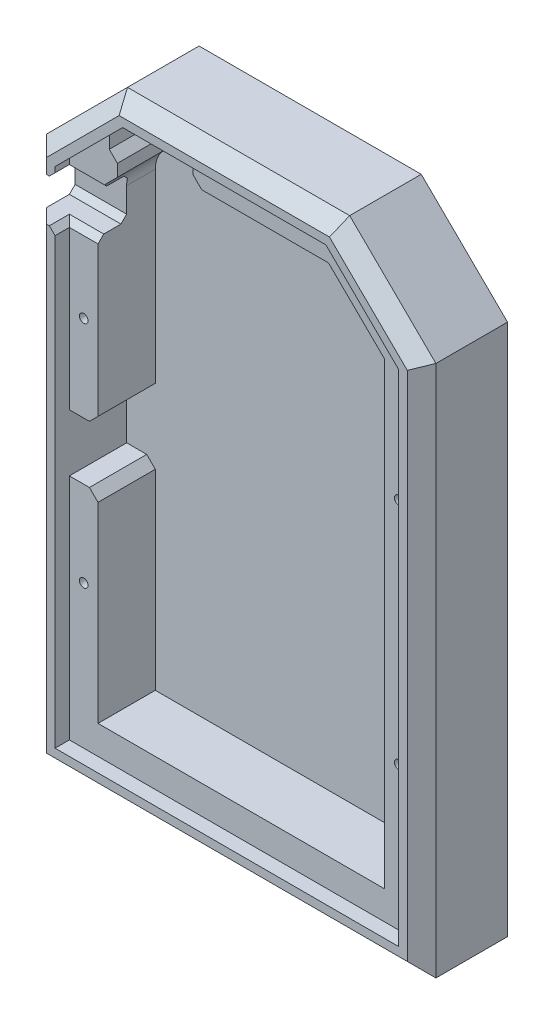
from build123d import *

# Parameters (mm, degrees)
SKETCH1_R               = 1.5
SKETCH1_W               = 20
SKETCH1_H               = 10
SKETCH1_H_2             = 2.227118871
BOSS_EXTRUDE1_DEPTH     = 5
SKETCH1_3_R             = 1.5
BOSS_EXTRUDE2_DEPTH     = 25
BOSS_EXTRUDE3_START     = 25
BOSS_EXTRUDE3_DEPTH     = 5
CHAMFER1_SIZE           = 5
CHAMFER2_SIZE           = 3
CUT_EXTRUDE1_DEPTH      = 5
CUT_EXTRUDE1_DEPTH_BACK = 15
SKETCH2_R               = 1.5
SKETCH2_W               = 25.232105948
SKETCH2_H               = 15
CHAMFER3_SIZE           = 2
FILLET1_R               = 10


with BuildPart() as part:
    # Sketch1 → Boss-Extrude1 (new body)
    # profile 1 of 12: a face of its own
    with BuildSketch(Plane(origin=(0, 0, 0), x_dir=(0, 1, 0), z_dir=(0, 0, 1))):
        Polygon((177.850961936, -128), (205.201570355, -100.211781846), (207.5, -97.876577327), (207.5, -94.6), (207.5, -23.6), (207.5, -20.286291501), (205.156854249, -17.943145751), (200.801342876, -13.587634377), (179.213708499, 8), (-8, 8), (-8, -128), align=None)
        Polygon((99.85, 0), (175.9, 0), (187.7, -11.8), (199.5, -23.6), (199.5, -43.189183287), (199.5, -94.6), (174.5, -120), (0, -120), (0, 0), (79.85, 0), align=None, mode=Mode.SUBTRACT)
    # profile 2 of 12: a face of its own
    with BuildSketch(Plane(origin=(0, 0, 0), x_dir=(0, 1, 0), z_dir=(0, 0, 1))):
        Polygon((79.85, -10), (79.85, 0), (0, 0), (0, -120), (174.5, -120), (199.5, -94.6), (199.5, -43.189183287), (189.5, -43.189183287), (189.5, -90.504278342), (170.31129758, -110), (10, -110), (10, -10), align=None)
        with Locations((50, -115)):
            Circle(SKETCH1_R, mode=Mode.SUBTRACT)
        with Locations((130, -115)):
            Circle(SKETCH1_R, mode=Mode.SUBTRACT)
        with Locations((50, -5)):
            Circle(SKETCH1_R, mode=Mode.SUBTRACT)
    # profile 3 of 12: a face of its own
    with BuildSketch(Plane(origin=(0, 0, 0), x_dir=(0, 1, 0), z_dir=(0, 0, 1))):
        Polygon((169.825042534, -29.674957466), (180.628932188, -18.871067812), (171.757864376, -10), (99.85, -10), (99.85, -12.227118871), (79.85, -12.227118871), (79.85, -10), (10, -10), (10, -110), (170.31129758, -110), (189.5, -90.504278342), (189.5, -43.189183287), (183.339268355, -43.189183287), align=None)
    # profile 4 of 12: a face of its own
    with BuildSketch(Plane(origin=(0, 0, 0), x_dir=(0, 1, 0), z_dir=(0, 0, 1))):
        Polygon((199.5, -23.6), (187.7, -11.8), (180.628932188, -18.871067812), (189.5, -27.742135624), (189.5, -43.189183287), (199.5, -43.189183287), align=None)
    # profile 5 of 12: a face of its own
    with BuildSketch(Plane(origin=(0, 0, 0), x_dir=(0, 1, 0), z_dir=(0, 0, 1))):
        Polygon((187.7, -11.8), (175.9, 0), (99.85, 0), (99.85, -10), (171.757864376, -10), (180.628932188, -18.871067812), align=None)
        with Locations((130, -5)):
            Circle(SKETCH1_R, mode=Mode.SUBTRACT)
    # profile 6 of 12: a face of its own
    with BuildSketch(Plane(origin=(0, 0, 0), x_dir=(0, 1, 0), z_dir=(0, 0, 1))):
        Polygon((189.5, -27.742135624), (180.628932188, -18.871067812), (169.825042534, -29.674957466), (183.339268355, -43.189183287), (189.5, -43.189183287), align=None)
    # profile 7 of 12: a face of its own
    with BuildSketch(Plane(origin=(0, 0, 0), x_dir=(0, 1, 0), z_dir=(0, 0, 1))):
        with Locations((89.85, -5)):
            Rectangle(SKETCH1_W, SKETCH1_H)
    # profile 8 of 12: a face of its own
    with BuildSketch(Plane(origin=(0, 0, 0), x_dir=(0, 1, 0), z_dir=(0, 0, 1))):
        with Locations((89.85, -11.113559436)):
            Rectangle(SKETCH1_W, SKETCH1_H_2)
    # profile 9 of 12: a face of its own
    with BuildSketch(Plane(origin=(0, 0, 0), x_dir=(0, 1, 0), z_dir=(0, 0, 1))):
        with Locations((50, -5)):
            Circle(SKETCH1_R)
    # profile 10 of 12: a face of its own
    with BuildSketch(Plane(origin=(0, 0, 0), x_dir=(0, 1, 0), z_dir=(0, 0, 1))):
        with Locations((130, -5)):
            Circle(SKETCH1_R)
    # profile 11 of 12: a face of its own
    with BuildSketch(Plane(origin=(0, 0, 0), x_dir=(0, 1, 0), z_dir=(0, 0, 1))):
        with Locations((130, -115)):
            Circle(SKETCH1_R)
    # profile 12 of 12: a face of its own
    with BuildSketch(Plane(origin=(0, 0, 0), x_dir=(0, 1, 0), z_dir=(0, 0, 1))):
        with Locations((50, -115)):
            Circle(SKETCH1_R)
    extrude(amount=BOSS_EXTRUDE1_DEPTH)

    # Sketch1<3> → Boss-Extrude2 (add)
    # profile 1 of 3: a face of its own
    with BuildSketch(Plane(origin=(0, 0, 0), x_dir=(0, 1, 0), z_dir=(0, 0, 1))):
        Polygon((177.850961936, -128), (205.201570355, -100.211781846), (207.5, -97.876577327), (207.5, -94.6), (207.5, -23.6), (207.5, -20.286291501), (205.156854249, -17.943145751), (200.801342876, -13.587634377), (179.213708499, 8), (-8, 8), (-8, -128), align=None)
        Polygon((99.85, 0), (175.9, 0), (187.7, -11.8), (199.5, -23.6), (199.5, -43.189183287), (199.5, -94.6), (174.5, -120), (0, -120), (0, 0), (79.85, 0), align=None, mode=Mode.SUBTRACT)
    # profile 2 of 3: a face of its own
    with BuildSketch(Plane(origin=(0, 0, 0), x_dir=(0, 1, 0), z_dir=(0, 0, 1))):
        Polygon((187.7, -11.8), (175.9, 0), (99.85, 0), (99.85, -10), (171.757864376, -10), (180.628932188, -18.871067812), align=None)
        with Locations(Location((130, -5, 0), (0, 0, 270))):
            Circle(SKETCH1_3_R, mode=Mode.SUBTRACT)
    # profile 3 of 3: a face of its own
    with BuildSketch(Plane(origin=(0, 0, 0), x_dir=(0, 1, 0), z_dir=(0, 0, 1))):
        Polygon((79.85, -10), (79.85, 0), (0, 0), (0, -120), (174.5, -120), (199.5, -94.6), (199.5, -43.189183287), (189.5, -43.189183287), (189.5, -90.504278342), (170.31129758, -110), (10, -110), (10, -10), align=None)
        with Locations(Location((50, -115, 0), (0, 0, 270))):
            Circle(SKETCH1_3_R, mode=Mode.SUBTRACT)
        with Locations(Location((130, -115, 0), (0, 0, 270))):
            Circle(SKETCH1_3_R, mode=Mode.SUBTRACT)
        with Locations(Location((50, -5, 0), (0, 0, 270))):
            Circle(SKETCH1_3_R, mode=Mode.SUBTRACT)
    extrude(amount=BOSS_EXTRUDE2_DEPTH)

    # Sketch1<4> → Boss-Extrude3 (add)
    with BuildSketch(Plane(origin=(0, 0, 0), x_dir=(0, 1, 0), z_dir=(0, 0, 1)).offset(BOSS_EXTRUDE3_START)):
        Polygon((177.850961936, -128), (205.201570355, -100.211781846), (207.5, -97.876577327), (207.5, -94.6), (207.5, -23.6), (207.5, -20.286291501), (205.156854249, -17.943145751), (200.801342876, -13.587634377), (179.213708499, 8), (-8, 8), (-8, -128), align=None)
        Polygon((99.85, 0), (175.9, 0), (187.7, -11.8), (199.5, -23.6), (199.5, -43.189183287), (199.5, -94.6), (174.5, -120), (0, -120), (0, 0), (79.85, 0), align=None, mode=Mode.SUBTRACT)
    extrude(amount=BOSS_EXTRUDE3_DEPTH)

    # Chamfer1
    chamfer1_edges = [part.edges().sort_by_distance(p)[0] for p in [
        (-8, 85.606854249, 30),
        (112.938288663, 192.675480968, 30),
        (59.081434414, 207.5, 30),
        (6.143145751, 193.356854249, 30),
        (60, -8, 30),
        (128, 84.925480968, 30),
    ]]
    chamfer(chamfer1_edges, length=CHAMFER1_SIZE)

    # Chamfer2
    chamfer2_edges = [part.edges().sort_by_distance(p)[0] for p in [
        (10, 79.85, 15),
        (10, 99.85, 15),
        (18.871067812, 180.628932188, 15),
        (11.8, 187.7, 15),
        (43.189183287, 199.5, 15),
        (43.189183287, 189.5, 15),
    ]]
    chamfer(chamfer2_edges, length=CHAMFER2_SIZE)

    # Sketch2 → Cut-Extrude1 (cut, two sides: drawn at the far end of the back side and taken through both)
    with BuildSketch(Plane.XY.offset(30).offset(-CUT_EXTRUDE1_DEPTH_BACK)):
        with Locations((5, 130)):
            Circle(SKETCH2_R)
        with Locations((3.376270431, 164.5)):
            Rectangle(SKETCH2_W, SKETCH2_H)
    extrude(amount=CUT_EXTRUDE1_DEPTH + CUT_EXTRUDE1_DEPTH_BACK, mode=Mode.SUBTRACT)

    # Chamfer3
    chamfer3_edges = [part.edges().sort_by_distance(p)[0] for p in [
        (5, 157, 25),
        (1, 157, 15),
        (1.121067812, 172, 15),
        (5.121067812, 172, 25),
        (0, 157, 27.5),
        (0, 172, 27.5),
    ]]
    chamfer(chamfer3_edges, length=CHAMFER3_SIZE)

    # Fillet1
    fillet1_edges = [part.edges().sort_by_distance(p)[0] for p in [
        (10, 171.757864376, 10.878932188),
    ]]
    fillet(fillet1_edges, radius=FILLET1_R)


solid = part.part
